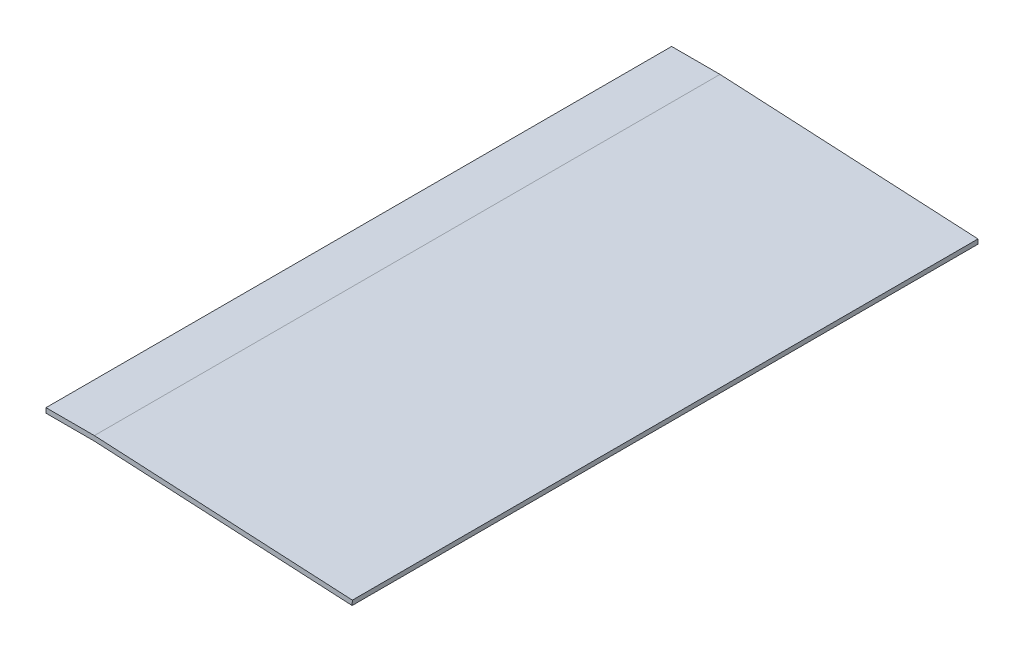
from build123d import *

# Parameters (mm, degrees)
SKETCH2_W           = 30
SKETCH2_H           = 3
BOSS_EXTRUDE1_DEPTH = 388


with BuildPart() as part:
    # Sketch2 → Boss-Extrude1 (new body)
    with BuildSketch(Plane.XY):
        with Locations((15, 1.5)):
            Rectangle(SKETCH2_W, SKETCH2_H)
        Polygon((189.842992131, -8.377016252), (190, -5.381127647), (30, 3), (30, 0), align=None)
    extrude(amount=BOSS_EXTRUDE1_DEPTH)


solid = part.part
